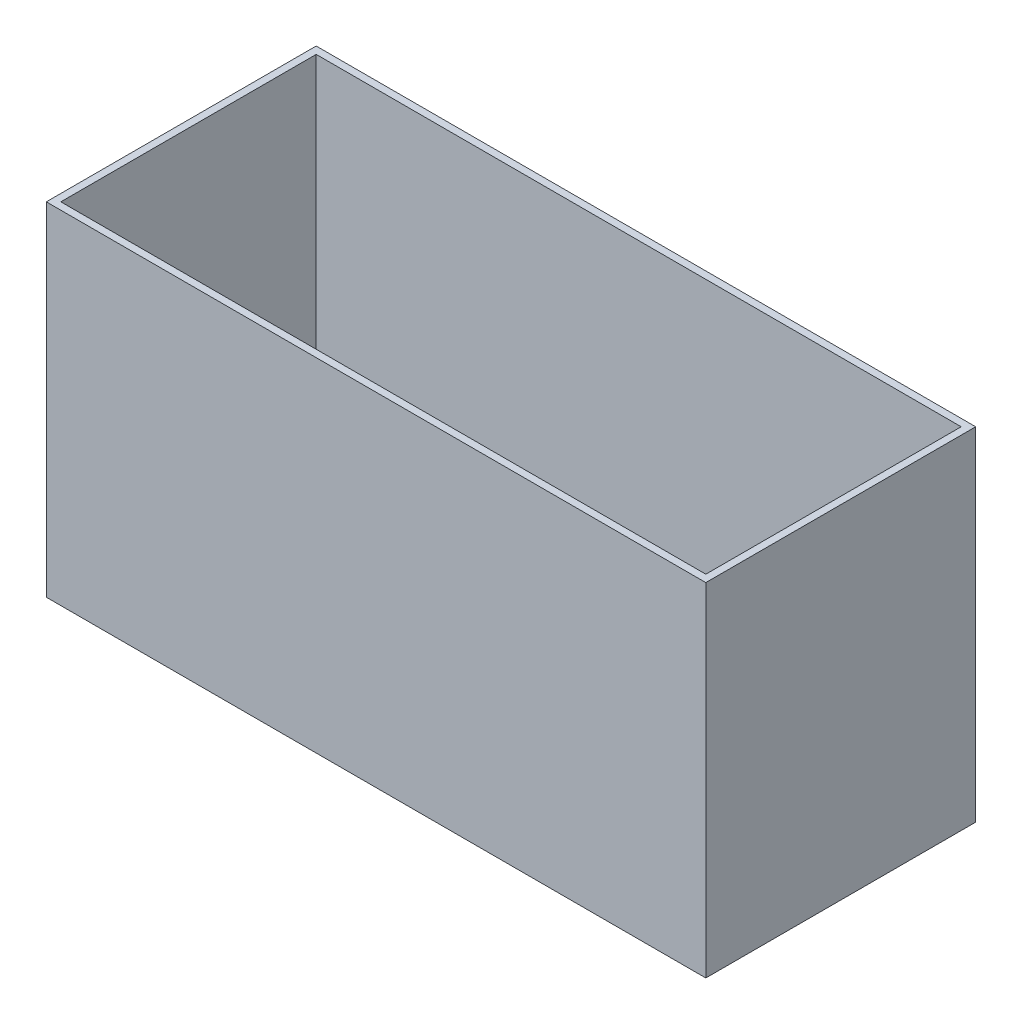
from build123d import *

# Parameters (mm, degrees)
SKETCH1_W          = 909
SKETCH1_H          = 372
BOTTOM_PLATE_DEPTH = 10
SKETCH2_W          = 909
SKETCH2_H          = 10
LEFT_WALL_DEPTH    = 472
SKETCH3_W          = 909
SKETCH3_H          = 10
RIGHT_WALL_DEPTH   = 472
SKETCH4_W          = 10
SKETCH4_H          = 352
BACK_WALL_DEPTH    = 472
SKETCH5_W          = 10
SKETCH5_H          = 352
FRONT_WALL_DEPTH   = 472


with BuildPart() as part:
    # Sketch1 → Bottom Plate (new body)
    with BuildSketch(Plane(origin=(0, 0, 0), x_dir=(1, 0, 0), z_dir=(0, 1, 0))):
        Rectangle(SKETCH1_W, SKETCH1_H)
    extrude(amount=BOTTOM_PLATE_DEPTH)

    # Sketch2 → Left Wall (add)
    with BuildSketch(Plane(origin=(0, 0, 0), x_dir=(1, 0, 0), z_dir=(0, 1, 0))):
        with Locations((0, 181)):
            Rectangle(SKETCH2_W, SKETCH2_H)
    extrude(amount=LEFT_WALL_DEPTH)

    # Sketch3 → Right Wall (add)
    with BuildSketch(Plane(origin=(0, 0, 0), x_dir=(1, 0, 0), z_dir=(0, 1, 0))):
        with Locations((0, -181)):
            Rectangle(SKETCH3_W, SKETCH3_H)
    extrude(amount=RIGHT_WALL_DEPTH)

    # Sketch4 → Back Wall (add)
    with BuildSketch(Plane(origin=(0, 0, 0), x_dir=(1, 0, 0), z_dir=(0, 1, 0))):
        with Locations((449.5, 0)):
            Rectangle(SKETCH4_W, SKETCH4_H)
    extrude(amount=BACK_WALL_DEPTH)

    # Sketch5 → Front Wall (add)
    with BuildSketch(Plane(origin=(0, 0, 0), x_dir=(1, 0, 0), z_dir=(0, 1, 0))):
        with Locations((-449.5, 0)):
            Rectangle(SKETCH5_W, SKETCH5_H)
    extrude(amount=FRONT_WALL_DEPTH)


solid = part.part
